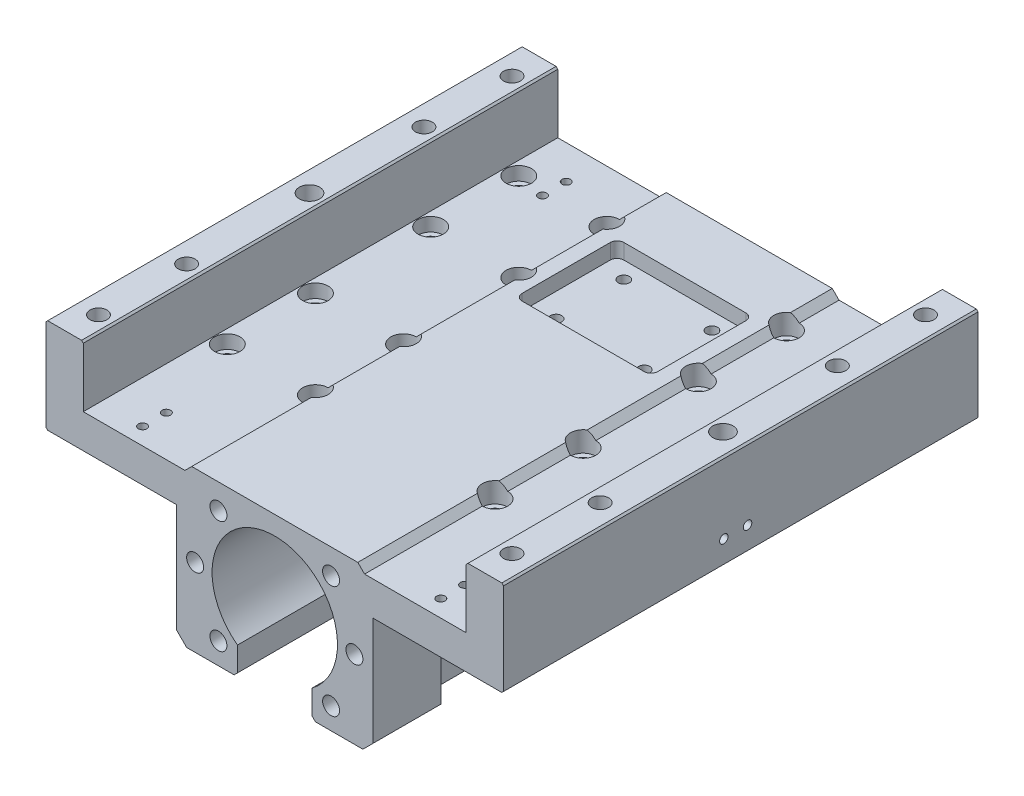
from build123d import *

# Parameters (mm, degrees)
SKETCH_1_W                  = 135
SKETCH_1_H                  = 63
EXTRUDE_1_DEPTH             = 140
CUT_EXTRUDE_1_REACH         = 162.488
SKETCH_2_W                  = 38.5
SKETCH_2_H                  = 35
CUT_EXTRUDE_2_REACH         = 162.488
CUT_EXTRUDE_3_DEPTH         = 70
CUT_EXTRUDE_4_REACH         = 107.149
CHAMFER_1_SIZE              = 3
CHAMFER_2_SIZE              = 0.5
CHAMFER_3_SIZE              = 1
SKETCH_7_W                  = 8
SKETCH_7_H                  = 35
CUT_EXTRUDE_5_DEPTH         = 120
CUT_EXTRUDE_6_DEPTH         = 4.5
HOLE_WIZARD_M4_1_D          = 3.3
HOLE_WIZARD_M4_1_DEPTH      = 8
HOLE_WIZARD_M4_1_TIP        = 0.991420021
HOLE_WIZARD_M6_1_AT_2_COUNT = 2
HOLE_WIZARD_M6_1_AT_2_PITCH = 26
HOLE_WIZARD_M6_1_AT_3_COUNT = 2
HOLE_WIZARD_M6_1_AT_3_PITCH = 122
HOLE_WIZARD_M6_1_AT_4_COUNT = 2
HOLE_WIZARD_M6_1_AT_4_PITCH = 96
SKETCH_13_R                 = 3
CUT_EXTRUDE_7_DEPTH         = 8
SKETCH_14_R                 = 3.75
CUT_EXTRUDE_8_DEPTH         = 6
CUT_EXTRUDE_9_REACH         = 162.74
SKETCH_15_R                 = 2.25
PATTERN_LINEAR_1_COUNT      = 2
PATTERN_LINEAR_1_PITCH      = 60
MIRROR_2_COPY_1_SKETCH_R    = 3.75
MIRROR_2_COPY_1_DEPTH       = 6
MIRROR_2_COPY_2_REACH       = 162.74
MIRROR_2_COPY_2_SKETCH_R    = 2.25
CUT_EXTRUDE_10_REACH        = 163.806
SKETCH_16_R                 = 1.25
PATTERN_LINEAR_2_COUNT      = 2
PATTERN_LINEAR_2_PITCH      = 118
HOLE_WIZARD_M6_2_D          = 5
HOLE_WIZARD_M6_2_DEPTH      = 15
HOLE_WIZARD_M6_2_TIP        = 1.502151548
HOLE_WIZARD_M3_1_AT_2_COUNT = 2
HOLE_WIZARD_M3_1_AT_2_PITCH = 7


with BuildPart() as part:
    # 草图1 → 凸台-拉伸1 (new body)
    with BuildSketch(Plane.XY):
        with Locations((0, 8.5)):
            Rectangle(SKETCH_1_W, SKETCH_1_H)
    extrude(amount=EXTRUDE_1_DEPTH)

    # 草图2 → 切除-拉伸1 (cut, up to next)
    with BuildSketch(Plane.XY.offset(140), mode=Mode.PRIVATE) as cut_extrude_1_sk1:
        with Locations((48.25, -5.5)):
            Rectangle(SKETCH_2_W, SKETCH_2_H)
    cut_extrude_1_tool1 = extrude(cut_extrude_1_sk1.sketch, amount=-CUT_EXTRUDE_1_REACH, mode=Mode.PRIVATE) & part.part
    # 草图2 → 切除-拉伸1 (cut, up to next)
    with BuildSketch(Plane.XY.offset(140), mode=Mode.PRIVATE) as cut_extrude_1_sk2:
        with Locations((-48.25, -5.5)):
            Rectangle(SKETCH_2_W, SKETCH_2_H)
    cut_extrude_1_tool2 = extrude(cut_extrude_1_sk2.sketch, amount=-CUT_EXTRUDE_1_REACH, mode=Mode.PRIVATE) & part.part
    add(cut_extrude_1_tool1.solids().sort_by_distance((48.25, -5.5, 140))[0], mode=Mode.SUBTRACT)
    add(cut_extrude_1_tool2.solids().sort_by_distance((-48.25, -5.5, 140))[0], mode=Mode.SUBTRACT)

    # 草图3 → 切除-拉伸2 (cut, up to next)
    with BuildSketch(Plane.XY.offset(140), mode=Mode.PRIVATE) as cut_extrude_2_sk1:
        Polygon((-56.5, 40), (-56.5, 22), (-26.5, 22), (-24.5, 24), (24.5, 24), (26.5, 22), (56.5, 22), (56.5, 40), align=None)
    cut_extrude_2_tool1 = extrude(cut_extrude_2_sk1.sketch, amount=-CUT_EXTRUDE_2_REACH, mode=Mode.PRIVATE) & part.part
    add(cut_extrude_2_tool1.solids().sort_by_distance((0, 31.42305, 140))[0], mode=Mode.SUBTRACT)

    # 草图4 → 切除-拉伸3 (cut)
    with BuildSketch(Plane.XY.offset(140)):
        with BuildLine():
            Line((-11, -23), (-11, -14.874474781))
            ThreePointArc((-11, -14.874474781), (0, 18.5), (11, -14.874474781))
            Line((11, -14.874474781), (11, -23))
            Line((11, -23), (-11, -23))
        make_face()
    extrude(amount=-CUT_EXTRUDE_3_DEPTH, mode=Mode.SUBTRACT)

    # 草图5 → 切除-拉伸4 (cut, up to next)
    with BuildSketch(Plane.XY.offset(70), mode=Mode.PRIVATE) as cut_extrude_4_sk1:
        with BuildLine():
            Line((-11, -23), (-11, -9.447221814))
            ThreePointArc((-11, -9.447221814), (0, 14.5), (11, -9.447221814))
            Line((11, -9.447221814), (11, -23))
            Line((11, -23), (-11, -23))
        make_face()
    cut_extrude_4_tool1 = extrude(cut_extrude_4_sk1.sketch, amount=-CUT_EXTRUDE_4_REACH, mode=Mode.PRIVATE) & part.part
    add(cut_extrude_4_tool1.solids().sort_by_distance((0, -4.480728, 70))[0], mode=Mode.SUBTRACT)

    # 倒角1
    chamfer_1_edges = [part.edges().sort_by_distance(p)[0] for p in [
        (29, -23, 70),
        (-29, -23, 70),
    ]]
    chamfer(chamfer_1_edges, length=CHAMFER_1_SIZE)

    # 倒角2
    chamfer_2_edges = [part.edges().sort_by_distance(p)[0] for p in [
        (67.5, 12, 70),
        (-67.5, 12, 70),
        (-56.5, 40, 70),
        (56.5, 40, 70),
        (-67.5, 40, 70),
        (67.5, 40, 70),
    ]]
    chamfer(chamfer_2_edges, length=CHAMFER_2_SIZE)

    # 倒角3
    chamfer_3_edges = [part.edges().sort_by_distance(p)[0] for p in [
        (11, -23, 70),
        (-11, -23, 70),
    ]]
    chamfer(chamfer_3_edges, length=CHAMFER_3_SIZE)

    # 草图7 → 切除-拉伸5 (cut)
    with BuildSketch(Plane(origin=(0, 0, 0), x_dir=(-1, 0, 0), z_dir=(0, 0, -1))):
        with Locations((-25, -5.5)):
            Rectangle(SKETCH_7_W, SKETCH_7_H)
        with Locations((25, -5.5)):
            Rectangle(SKETCH_7_W, SKETCH_7_H)
    extrude(amount=-CUT_EXTRUDE_5_DEPTH, mode=Mode.SUBTRACT)

    # 草图8 → 切除-拉伸6 (cut)
    with BuildSketch(Plane(origin=(0, 24, 0), x_dir=(1, 0, 0), z_dir=(0, 1, 0))):
        with BuildLine():
            Line((-18, -19), (18, -19))
            ThreePointArc((18, -19), (19.414213562, -19.585786438), (20, -21))
            Line((20, -21), (20, -47))
            ThreePointArc((20, -47), (19.414213562, -48.414213562), (18, -49))
            Line((18, -49), (-18, -49))
            ThreePointArc((-18, -49), (-19.414213562, -48.414213562), (-20, -47))
            Line((-20, -47), (-20, -21))
            ThreePointArc((-20, -21), (-19.414213562, -19.585786438), (-18, -19))
        make_face()
    extrude(amount=-CUT_EXTRUDE_6_DEPTH, mode=Mode.SUBTRACT)

    # M4 螺纹孔1
    with Locations(Plane(origin=(13, 19.5, 24), x_dir=(1, 0, 0), z_dir=(0, 1, 0))):
        with Locations((0, 0), (-26.006550165, 0), (-26, -20), (0, -20)):
            Hole(HOLE_WIZARD_M4_1_D / 2, depth=HOLE_WIZARD_M4_1_DEPTH)
            with Locations((0, 0, -(HOLE_WIZARD_M4_1_DEPTH + HOLE_WIZARD_M4_1_TIP / 2))):  # 118° drill point
                Cone(0, HOLE_WIZARD_M4_1_D / 2, HOLE_WIZARD_M4_1_TIP, mode=Mode.SUBTRACT)

    # 草图12 → M6 螺纹孔1 (revolve, cut)
    with BuildSketch(Plane(origin=(-61, 40, 9), x_dir=(0, 0, 1), z_dir=(1, 0, 0))):
        Polygon((0, 0), (0, 16.502151548), (2.5, 15), (2.5, 0), align=None)
    hole_wizard_m6_1 = revolve(axis=Axis((-61, 46.35, 9), (0, -1, 0)), mode=Mode.SUBTRACT)

    # M6 螺纹孔1 at 2: M6 螺纹孔1 ×2
    with Locations(*[(0, 0, i * HOLE_WIZARD_M6_1_AT_2_PITCH) for i in range(1, HOLE_WIZARD_M6_1_AT_2_COUNT)]):
        add(hole_wizard_m6_1, mode=Mode.SUBTRACT)

    # M6 螺纹孔1 at 3: M6 螺纹孔1 ×2
    with Locations(*[(0, 0, i * HOLE_WIZARD_M6_1_AT_3_PITCH) for i in range(1, HOLE_WIZARD_M6_1_AT_3_COUNT)]):
        add(hole_wizard_m6_1, mode=Mode.SUBTRACT)

    # M6 螺纹孔1 at 4: M6 螺纹孔1 ×2
    with Locations(*[(0, 0, i * HOLE_WIZARD_M6_1_AT_4_PITCH) for i in range(1, HOLE_WIZARD_M6_1_AT_4_COUNT)]):
        add(hole_wizard_m6_1, mode=Mode.SUBTRACT)

    # 草图13 → 切除-拉伸7 (cut)
    with BuildSketch(Plane(origin=(0, 40, 0), x_dir=(1, 0, 0), z_dir=(0, 1, 0))):
        with Locations(Location((-61, -68.754781546, 0), (0, 0, 180))):
            Circle(SKETCH_13_R)
    cut_extrude_7 = extrude(amount=-CUT_EXTRUDE_7_DEPTH, mode=Mode.SUBTRACT)

    # 镜向1: M6 螺纹孔1, 切除-拉伸7 across plane
    add(hole_wizard_m6_1.mirror(Plane(origin=(0, 0, 0), x_dir=(0, 0, 1), z_dir=(1, 0, 0))), mode=Mode.SUBTRACT)
    add(cut_extrude_7.mirror(Plane(origin=(0, 0, 0), x_dir=(0, 0, 1), z_dir=(1, 0, 0))), mode=Mode.SUBTRACT)

    # 镜向1 copy 1 sketch → 镜向1 copy 1 (revolve, cut)
    with BuildSketch(Plane(origin=(61, 40, 35), x_dir=(0, 0, 1), z_dir=(-1, 0, 0))):
        Polygon((0, 0), (0, -16.502151548), (2.5, -15), (2.5, 0), align=None)
    revolve(axis=Axis((61, 46.35, 35), (0, 1, 0)), mode=Mode.SUBTRACT)

    # 镜向1 copy 2 sketch → 镜向1 copy 2 (revolve, cut)
    with BuildSketch(Plane(origin=(61, 40, 131), x_dir=(0, 0, 1), z_dir=(-1, 0, 0))):
        Polygon((0, 0), (0, -16.502151548), (2.5, -15), (2.5, 0), align=None)
    revolve(axis=Axis((61, 46.35, 131), (0, 1, 0)), mode=Mode.SUBTRACT)

    # 镜向1 copy 3 sketch → 镜向1 copy 3 (revolve, cut)
    with BuildSketch(Plane(origin=(61, 40, 105), x_dir=(0, 0, 1), z_dir=(-1, 0, 0))):
        Polygon((0, 0), (0, -16.502151548), (2.5, -15), (2.5, 0), align=None)
    revolve(axis=Axis((61, 46.35, 105), (0, 1, 0)), mode=Mode.SUBTRACT)

    # 草图14 → 切除-拉伸8 (cut)
    with BuildSketch(Plane(origin=(0, 24, 0), x_dir=(1, 0, 0), z_dir=(0, 1, 0))):
        with Locations(Location((-52.5, -15.5, 0), (0, 0, 180))):
            Circle(SKETCH_14_R)
        with Locations(Location((-26.5, -15.5, 0), (0, 0, 180))):
            Circle(SKETCH_14_R)
        with Locations(Location((-52.5, -41.5, 0), (0, 0, 180))):
            Circle(SKETCH_14_R)
        with Locations(Location((-26.5, -41.5, 0), (0, 0, 180))):
            Circle(SKETCH_14_R)
    cut_extrude_8 = extrude(amount=-CUT_EXTRUDE_8_DEPTH, mode=Mode.SUBTRACT)

    # 草图15 → 切除-拉伸9 (cut, up to next)
    with BuildSketch(Plane(origin=(0, 18, 0), x_dir=(1, 0, 0), z_dir=(0, 1, 0)), mode=Mode.PRIVATE) as cut_extrude_9_sk1:
        with Locations(Location((-26.5, -15.5, 0), (0, 0, 180))):
            Circle(SKETCH_15_R)
    cut_extrude_9_tool1 = extrude(cut_extrude_9_sk1.sketch, amount=-CUT_EXTRUDE_9_REACH, mode=Mode.PRIVATE) & part.part
    # 草图15 → 切除-拉伸9 (cut, up to next)
    with BuildSketch(Plane(origin=(0, 18, 0), x_dir=(1, 0, 0), z_dir=(0, 1, 0)), mode=Mode.PRIVATE) as cut_extrude_9_sk2:
        with Locations(Location((-26.5, -41.5, 0), (0, 0, 180))):
            Circle(SKETCH_15_R)
    cut_extrude_9_tool2 = extrude(cut_extrude_9_sk2.sketch, amount=-CUT_EXTRUDE_9_REACH, mode=Mode.PRIVATE) & part.part
    # 草图15 → 切除-拉伸9 (cut, up to next)
    with BuildSketch(Plane(origin=(0, 18, 0), x_dir=(1, 0, 0), z_dir=(0, 1, 0)), mode=Mode.PRIVATE) as cut_extrude_9_sk3:
        with Locations(Location((-52.5, -41.5, 0), (0, 0, 180))):
            Circle(SKETCH_15_R)
    cut_extrude_9_tool3 = extrude(cut_extrude_9_sk3.sketch, amount=-CUT_EXTRUDE_9_REACH, mode=Mode.PRIVATE) & part.part
    # 草图15 → 切除-拉伸9 (cut, up to next)
    with BuildSketch(Plane(origin=(0, 18, 0), x_dir=(1, 0, 0), z_dir=(0, 1, 0)), mode=Mode.PRIVATE) as cut_extrude_9_sk4:
        with Locations(Location((-52.5, -15.5, 0), (0, 0, 180))):
            Circle(SKETCH_15_R)
    cut_extrude_9_tool4 = extrude(cut_extrude_9_sk4.sketch, amount=-CUT_EXTRUDE_9_REACH, mode=Mode.PRIVATE) & part.part
    cut_extrude_9_1 = cut_extrude_9_tool1.solids().sort_by_distance((-26.5, 18, 15.5))[0]
    add(cut_extrude_9_1, mode=Mode.SUBTRACT)
    cut_extrude_9_2 = cut_extrude_9_tool2.solids().sort_by_distance((-26.5, 18, 41.5))[0]
    add(cut_extrude_9_2, mode=Mode.SUBTRACT)
    cut_extrude_9_3 = cut_extrude_9_tool3.solids().sort_by_distance((-52.5, 18, 41.5))[0]
    add(cut_extrude_9_3, mode=Mode.SUBTRACT)
    cut_extrude_9_4 = cut_extrude_9_tool4.solids().sort_by_distance((-52.5, 18, 15.5))[0]
    add(cut_extrude_9_4, mode=Mode.SUBTRACT)
    cut_extrude_9 = cut_extrude_9_1 + cut_extrude_9_2 + cut_extrude_9_3 + cut_extrude_9_4  # 切除-拉伸9 as one shape, for the pattern or mirror that repeats it

    # 阵列(线性)1: 切除-拉伸8, 切除-拉伸9 ×2
    with Locations(*[(0, 0, i * PATTERN_LINEAR_1_PITCH) for i in range(1, PATTERN_LINEAR_1_COUNT)]):
        add(cut_extrude_8, mode=Mode.SUBTRACT)
        add(cut_extrude_9, mode=Mode.SUBTRACT)

    # 镜向2: 切除-拉伸8, 切除-拉伸9 across plane
    add(cut_extrude_8.mirror(Plane(origin=(0, 0, 0), x_dir=(0, 0, 1), z_dir=(1, 0, 0))), mode=Mode.SUBTRACT)
    add(cut_extrude_9.mirror(Plane(origin=(0, 0, 0), x_dir=(0, 0, 1), z_dir=(1, 0, 0))), mode=Mode.SUBTRACT)

    # 镜向2 copy 1 sketch → 镜向2 copy 1 (cut)
    with BuildSketch(Plane(origin=(0, 24, 60), x_dir=(-1, 0, 0), z_dir=(0, 1, 0))):
        with Locations((-52.5, 15.5)):
            Circle(MIRROR_2_COPY_1_SKETCH_R)
        with Locations((-26.5, 15.5)):
            Circle(MIRROR_2_COPY_1_SKETCH_R)
        with Locations((-52.5, 41.5)):
            Circle(MIRROR_2_COPY_1_SKETCH_R)
        with Locations((-26.5, 41.5)):
            Circle(MIRROR_2_COPY_1_SKETCH_R)
    extrude(amount=-MIRROR_2_COPY_1_DEPTH, mode=Mode.SUBTRACT)

    # 镜向2 copy 2 sketch → 镜向2 copy 2 (cut, up to next)
    with BuildSketch(Plane(origin=(0, 18, 60), x_dir=(-1, 0, 0), z_dir=(0, 1, 0)), mode=Mode.PRIVATE) as mirror_2_copy_2_sk1:
        with Locations((-26.5, 15.5)):
            Circle(MIRROR_2_COPY_2_SKETCH_R)
    mirror_2_copy_2_tool1 = extrude(mirror_2_copy_2_sk1.sketch, amount=-MIRROR_2_COPY_2_REACH, mode=Mode.PRIVATE) & part.part
    # 镜向2 copy 2 sketch → 镜向2 copy 2 (cut, up to next)
    with BuildSketch(Plane(origin=(0, 18, 60), x_dir=(-1, 0, 0), z_dir=(0, 1, 0)), mode=Mode.PRIVATE) as mirror_2_copy_2_sk2:
        with Locations((-26.5, 41.5)):
            Circle(MIRROR_2_COPY_2_SKETCH_R)
    mirror_2_copy_2_tool2 = extrude(mirror_2_copy_2_sk2.sketch, amount=-MIRROR_2_COPY_2_REACH, mode=Mode.PRIVATE) & part.part
    # 镜向2 copy 2 sketch → 镜向2 copy 2 (cut, up to next)
    with BuildSketch(Plane(origin=(0, 18, 60), x_dir=(-1, 0, 0), z_dir=(0, 1, 0)), mode=Mode.PRIVATE) as mirror_2_copy_2_sk3:
        with Locations((-52.5, 41.5)):
            Circle(MIRROR_2_COPY_2_SKETCH_R)
    mirror_2_copy_2_tool3 = extrude(mirror_2_copy_2_sk3.sketch, amount=-MIRROR_2_COPY_2_REACH, mode=Mode.PRIVATE) & part.part
    # 镜向2 copy 2 sketch → 镜向2 copy 2 (cut, up to next)
    with BuildSketch(Plane(origin=(0, 18, 60), x_dir=(-1, 0, 0), z_dir=(0, 1, 0)), mode=Mode.PRIVATE) as mirror_2_copy_2_sk4:
        with Locations((-52.5, 15.5)):
            Circle(MIRROR_2_COPY_2_SKETCH_R)
    mirror_2_copy_2_tool4 = extrude(mirror_2_copy_2_sk4.sketch, amount=-MIRROR_2_COPY_2_REACH, mode=Mode.PRIVATE) & part.part
    add(mirror_2_copy_2_tool1.solids().sort_by_distance((26.5, 18, 75.5))[0], mode=Mode.SUBTRACT)
    add(mirror_2_copy_2_tool2.solids().sort_by_distance((26.5, 18, 101.5))[0], mode=Mode.SUBTRACT)
    add(mirror_2_copy_2_tool3.solids().sort_by_distance((52.5, 18, 101.5))[0], mode=Mode.SUBTRACT)
    add(mirror_2_copy_2_tool4.solids().sort_by_distance((52.5, 18, 75.5))[0], mode=Mode.SUBTRACT)

    # 草图16 → 切除-拉伸10 (cut, up to next)
    with BuildSketch(Plane(origin=(0, 22, 0), x_dir=(1, 0, 0), z_dir=(0, 1, 0)), mode=Mode.PRIVATE) as cut_extrude_10_sk1:
        with Locations(Location((-44, -10, 0), (0, 0, 270))):
            Circle(SKETCH_16_R)
    cut_extrude_10_tool1 = extrude(cut_extrude_10_sk1.sketch, amount=-CUT_EXTRUDE_10_REACH, mode=Mode.PRIVATE) & part.part
    # 草图16 → 切除-拉伸10 (cut, up to next)
    with BuildSketch(Plane(origin=(0, 22, 0), x_dir=(1, 0, 0), z_dir=(0, 1, 0)), mode=Mode.PRIVATE) as cut_extrude_10_sk2:
        with Locations(Location((-44, -17, 0), (0, 0, 270))):
            Circle(SKETCH_16_R)
    cut_extrude_10_tool2 = extrude(cut_extrude_10_sk2.sketch, amount=-CUT_EXTRUDE_10_REACH, mode=Mode.PRIVATE) & part.part
    # 草图16 → 切除-拉伸10 (cut, up to next)
    with BuildSketch(Plane(origin=(0, 22, 0), x_dir=(1, 0, 0), z_dir=(0, 1, 0)), mode=Mode.PRIVATE) as cut_extrude_10_sk3:
        with Locations(Location((44, -17, 0), (0, 0, 270))):
            Circle(SKETCH_16_R)
    cut_extrude_10_tool3 = extrude(cut_extrude_10_sk3.sketch, amount=-CUT_EXTRUDE_10_REACH, mode=Mode.PRIVATE) & part.part
    # 草图16 → 切除-拉伸10 (cut, up to next)
    with BuildSketch(Plane(origin=(0, 22, 0), x_dir=(1, 0, 0), z_dir=(0, 1, 0)), mode=Mode.PRIVATE) as cut_extrude_10_sk4:
        with Locations(Location((44, -10, 0), (0, 0, 270))):
            Circle(SKETCH_16_R)
    cut_extrude_10_tool4 = extrude(cut_extrude_10_sk4.sketch, amount=-CUT_EXTRUDE_10_REACH, mode=Mode.PRIVATE) & part.part
    cut_extrude_10_1 = cut_extrude_10_tool1.solids().sort_by_distance((-44, 22, 10))[0]
    add(cut_extrude_10_1, mode=Mode.SUBTRACT)
    cut_extrude_10_2 = cut_extrude_10_tool2.solids().sort_by_distance((-44, 22, 17))[0]
    add(cut_extrude_10_2, mode=Mode.SUBTRACT)
    cut_extrude_10_3 = cut_extrude_10_tool3.solids().sort_by_distance((44, 22, 17))[0]
    add(cut_extrude_10_3, mode=Mode.SUBTRACT)
    cut_extrude_10_4 = cut_extrude_10_tool4.solids().sort_by_distance((44, 22, 10))[0]
    add(cut_extrude_10_4, mode=Mode.SUBTRACT)
    cut_extrude_10 = cut_extrude_10_1 + cut_extrude_10_2 + cut_extrude_10_3 + cut_extrude_10_4  # 切除-拉伸10 as one shape, for the pattern or mirror that repeats it

    # 阵列(线性)2: 切除-拉伸10 ×2
    with Locations(*[(0, 0, i * PATTERN_LINEAR_2_PITCH) for i in range(1, PATTERN_LINEAR_2_COUNT)]):
        add(cut_extrude_10, mode=Mode.SUBTRACT)

    # M6 螺纹孔2
    with Locations(Plane(origin=(16.617009358, 16.617009358, 140), x_dir=(1, 0, 0), z_dir=(0, 0, 1))):
        with Locations((0, 0), (-33.234018716, 0), (-40.117009358, -16.617009358), (-33.234018716, -33.234018716), (0, -33.234018716), (6.882990642, -16.617009358)):
            Hole(HOLE_WIZARD_M6_2_D / 2, depth=HOLE_WIZARD_M6_2_DEPTH)
            with Locations((0, 0, -(HOLE_WIZARD_M6_2_DEPTH + HOLE_WIZARD_M6_2_TIP / 2))):  # 118° drill point
                Cone(0, HOLE_WIZARD_M6_2_D / 2, HOLE_WIZARD_M6_2_TIP, mode=Mode.SUBTRACT)

    # 草图20 → M3 螺纹孔1 (revolve, cut)
    with BuildSketch(Plane(origin=(-67.5, 19, 68), x_dir=(0, 0, 1), z_dir=(0, 1, 0))):
        Polygon((0, 0), (0, 8.751075774), (1.25, 8), (1.25, 0), align=None)
    hole_wizard_m3_1 = revolve(axis=Axis((-73.85, 19, 68), (1, 0, 0)), mode=Mode.SUBTRACT)

    # M3 螺纹孔1 at 2: M3 螺纹孔1 ×2
    with Locations(*[(0, 0, i * HOLE_WIZARD_M3_1_AT_2_PITCH) for i in range(1, HOLE_WIZARD_M3_1_AT_2_COUNT)]):
        add(hole_wizard_m3_1, mode=Mode.SUBTRACT)

    # 镜向3: M3 螺纹孔1 across plane
    add(hole_wizard_m3_1.mirror(Plane(origin=(0, 0, 0), x_dir=(0, 0, 1), z_dir=(1, 0, 0))), mode=Mode.SUBTRACT)

    # 镜向3 copy 1 sketch → 镜向3 copy 1 (revolve, cut)
    with BuildSketch(Plane(origin=(67.5, 19, 75), x_dir=(0, 0, 1), z_dir=(0, 1, 0))):
        Polygon((0, 0), (0, -8.751075774), (1.25, -8), (1.25, 0), align=None)
    revolve(axis=Axis((73.85, 19, 75), (1, 0, 0)), mode=Mode.SUBTRACT)


solid = part.part
